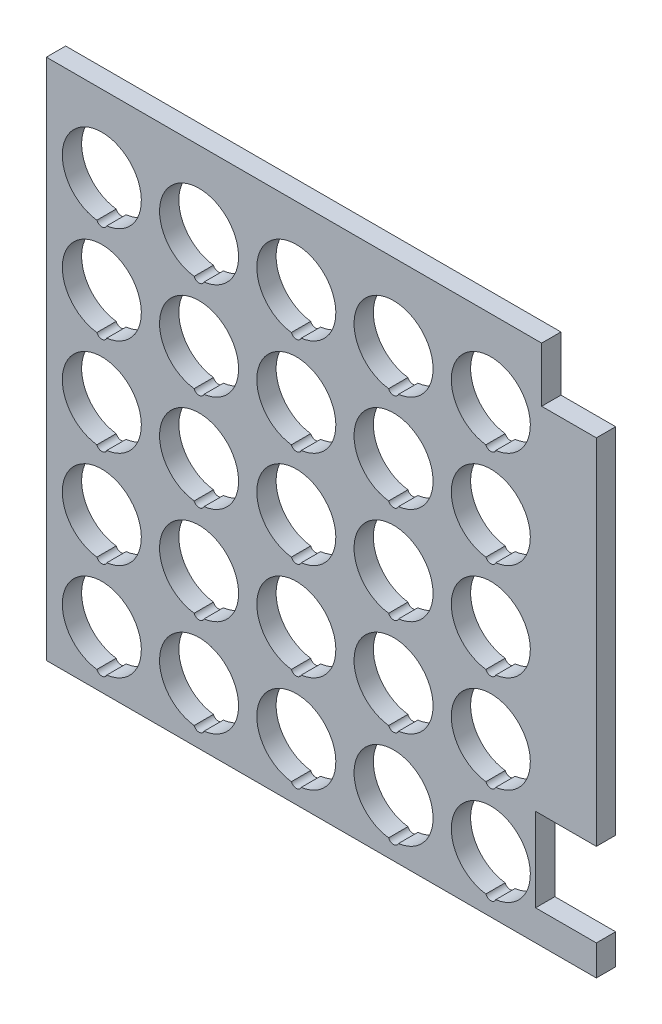
from build123d import *

# Parameters (mm, degrees)
SKETCH2_W           = 180.975
SKETCH2_H           = 161.925
BOSS_EXTRUDE1_DEPTH = 6.35
SKETCH6_W           = 180.975
SKETCH6_H           = 10
BOSS_EXTRUDE2_DEPTH = 6.35
SKETCH3_R           = 13
CUT_EXTRUDE1_DEPTH  = 243.923812645
SKETCH4_R           = 1.75
CUT_EXTRUDE9_DEPTH  = 243.923812645
SKETCH7_W           = 20
SKETCH7_H           = 27.5
SKETCH7_W_2         = 18
SKETCH7_H_2         = 18
CUT_EXTRUDE10_DEPTH = 243.923812645


with BuildPart() as part:
    # Sketch2 → Boss-Extrude1 (new body)
    with BuildSketch(Plane.XY):
        with Locations((90.4875, 80.9625)):
            Rectangle(SKETCH2_W, SKETCH2_H)
    extrude(amount=BOSS_EXTRUDE1_DEPTH)

    # Sketch6 → Boss-Extrude2 (add)
    with BuildSketch(Plane.XY.offset(6.35)):
        with Locations((90.4875, -5)):
            Rectangle(SKETCH6_W, SKETCH6_H)
    extrude(amount=-BOSS_EXTRUDE2_DEPTH)

    # Sketch3 → Cut-Extrude1 (cut, through all)
    with BuildSketch(Plane.XY.offset(6.35)):
        with Locations((18.25, 8.675)):
            Circle(SKETCH3_R)
        with Locations((50.25, 8.675)):
            Circle(SKETCH3_R)
        with Locations((82.25, 8.675)):
            Circle(SKETCH3_R)
        with Locations((114.25, 8.675)):
            Circle(SKETCH3_R)
        with Locations((146.25, 8.675)):
            Circle(SKETCH3_R)
        with Locations((50.25, 40.675)):
            Circle(SKETCH3_R)
        with Locations((82.25, 40.675)):
            Circle(SKETCH3_R)
        with Locations((114.25, 40.675)):
            Circle(SKETCH3_R)
        with Locations((146.25, 40.675)):
            Circle(SKETCH3_R)
        with Locations((50.25, 72.675)):
            Circle(SKETCH3_R)
        with Locations((82.25, 72.675)):
            Circle(SKETCH3_R)
        with Locations((114.25, 72.675)):
            Circle(SKETCH3_R)
        with Locations((146.25, 72.675)):
            Circle(SKETCH3_R)
        with Locations((50.25, 104.675)):
            Circle(SKETCH3_R)
        with Locations((82.25, 104.675)):
            Circle(SKETCH3_R)
        with Locations((114.25, 104.675)):
            Circle(SKETCH3_R)
        with Locations((146.25, 104.675)):
            Circle(SKETCH3_R)
        with Locations((50.25, 136.675)):
            Circle(SKETCH3_R)
        with Locations((82.25, 136.675)):
            Circle(SKETCH3_R)
        with Locations((114.25, 136.675)):
            Circle(SKETCH3_R)
        with Locations((146.25, 136.675)):
            Circle(SKETCH3_R)
        with Locations((18.25, 40.675)):
            Circle(SKETCH3_R)
        with Locations((18.25, 72.675)):
            Circle(SKETCH3_R)
        with Locations((18.25, 104.675)):
            Circle(SKETCH3_R)
        with Locations((18.25, 136.675)):
            Circle(SKETCH3_R)
    extrude(amount=-CUT_EXTRUDE1_DEPTH, mode=Mode.SUBTRACT)

    # Sketch4 → Cut-Extrude9 (cut, through all)
    with BuildSketch(Plane.XY.offset(6.35)):
        with Locations((18.25, -3.575)):
            Circle(SKETCH4_R)
        with Locations((50.25, -3.575)):
            Circle(SKETCH4_R)
        with Locations((82.25, -3.575)):
            Circle(SKETCH4_R)
        with Locations((114.25, -3.575)):
            Circle(SKETCH4_R)
        with Locations((146.25, -3.575)):
            Circle(SKETCH4_R)
        with Locations((50.25, 28.425)):
            Circle(SKETCH4_R)
        with Locations((82.25, 28.425)):
            Circle(SKETCH4_R)
        with Locations((114.25, 28.425)):
            Circle(SKETCH4_R)
        with Locations((146.25, 28.425)):
            Circle(SKETCH4_R)
        with Locations((50.25, 60.425)):
            Circle(SKETCH4_R)
        with Locations((82.25, 60.425)):
            Circle(SKETCH4_R)
        with Locations((114.25, 60.425)):
            Circle(SKETCH4_R)
        with Locations((146.25, 60.425)):
            Circle(SKETCH4_R)
        with Locations((50.25, 92.425)):
            Circle(SKETCH4_R)
        with Locations((82.25, 92.425)):
            Circle(SKETCH4_R)
        with Locations((114.25, 92.425)):
            Circle(SKETCH4_R)
        with Locations((146.25, 92.425)):
            Circle(SKETCH4_R)
        with Locations((50.25, 124.425)):
            Circle(SKETCH4_R)
        with Locations((82.25, 124.425)):
            Circle(SKETCH4_R)
        with Locations((114.25, 124.425)):
            Circle(SKETCH4_R)
        with Locations((146.25, 124.425)):
            Circle(SKETCH4_R)
        with Locations((18.25, 28.425)):
            Circle(SKETCH4_R)
        with Locations((18.25, 60.425)):
            Circle(SKETCH4_R)
        with Locations((18.25, 92.425)):
            Circle(SKETCH4_R)
        with Locations((18.25, 124.425)):
            Circle(SKETCH4_R)
    extrude(amount=-CUT_EXTRUDE9_DEPTH, mode=Mode.SUBTRACT)

    # Sketch7 → Cut-Extrude10 (cut, through all)
    with BuildSketch(Plane.XY.offset(6.35)):
        with Locations((170.975, 13.75)):
            Rectangle(SKETCH7_W, SKETCH7_H)
        with Locations((171.975, 152.925)):
            Rectangle(SKETCH7_W_2, SKETCH7_H_2)
    extrude(amount=-CUT_EXTRUDE10_DEPTH, mode=Mode.SUBTRACT)


solid = part.part
